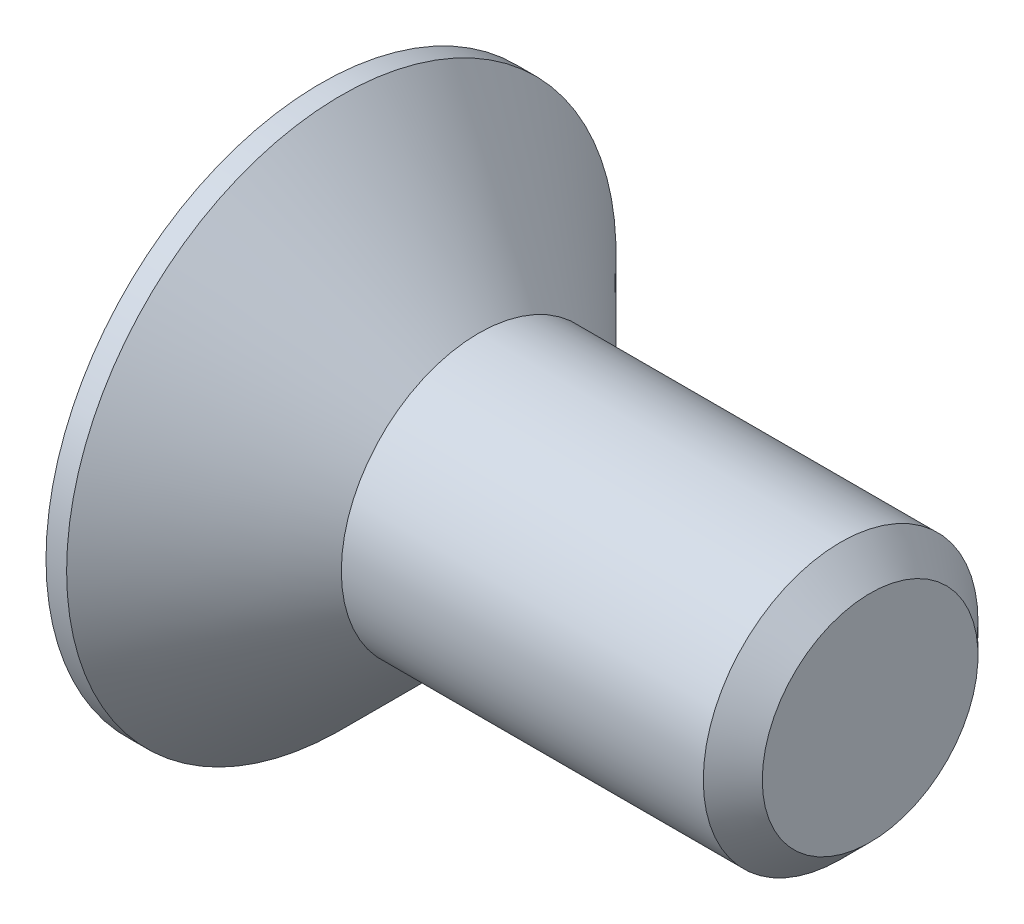
from build123d import *

# Parameters (mm, degrees)
SZKIC4_R                    = 2.25
DODANIE_WYCI_GNI_CIE1_DEPTH = 1.875


with BuildPart() as part:
    # Szkic1 → Obrót1 (revolve)
    with BuildSketch(Plane.XY):
        Polygon((0, 0), (0, 4), (0.3, 4), (2.3, 2), (2.3, 0), align=None)
    revolve(axis=Axis((2.3, 0, 0), (-1, 0, 0)))

    # Szkic2 → Obrót2 (revolve)
    with BuildSketch(Plane.XY):
        Polygon((2.3, 0), (2.3, 2), (7.5705, 2), (8, 1.5705), (8, 0), align=None)
    revolve(axis=Axis((8, 0, 0), (-1, 0, 0)))

    # Szkic3 → Wycięcie-obrót1 (revolve, cut)
    with BuildSketch(Plane.XY):
        Polygon((0, 0), (0, 1.95), (1.5, 1.95), (2.625833025, 0), align=None)
    revolve(axis=Axis((2.625833025, 0, 0), (-1, 0, 0)), mode=Mode.SUBTRACT)

    # Szkic4 → Dodanie-wyciągnięcie1 (add)
    with BuildSketch(Plane(origin=(0, 0, 0), x_dir=(0, 0, -1), z_dir=(1, 0, 0))):
        Circle(SZKIC4_R)
        Polygon((-1.25, 0.721687836), (-1.25, -0.721687836), (0, -1.443375673), (1.25, -0.721687836), (1.25, 0.721687836), (0, 1.443375673), align=None, mode=Mode.SUBTRACT)
    extrude(amount=DODANIE_WYCI_GNI_CIE1_DEPTH)


solid = part.part
